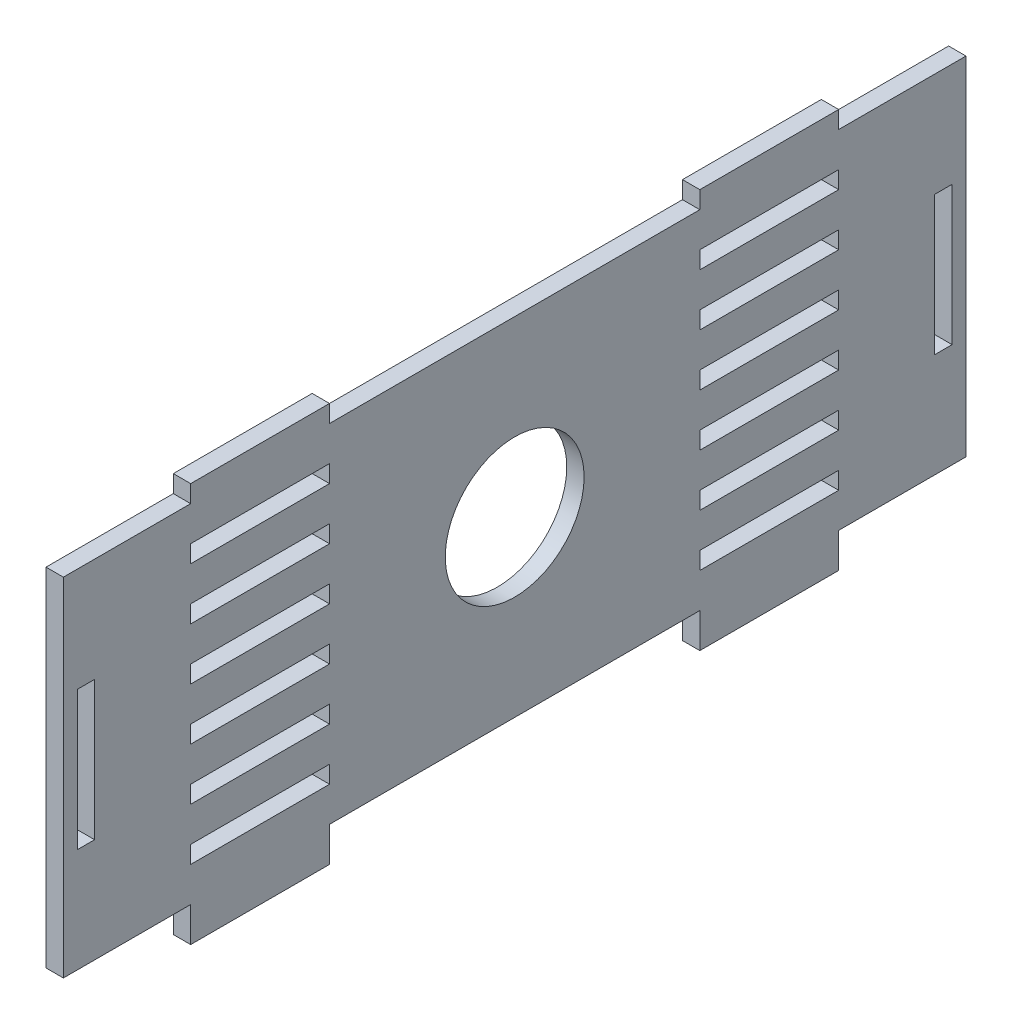
from build123d import *

# Parameters (mm, degrees)
SKETCH1_4_R         = 10
SKETCH1_4_W         = 2.5
SKETCH1_4_H         = 20
BOSS_EXTRUDE3_DEPTH = 1.25
SKETCH2_W           = 20
SKETCH2_H           = 2.5
CUT_EXTRUDE1_DEPTH  = 72.632743909


with BuildPart() as part:
    # Sketch1<4> → Boss-Extrude3 (new, symmetric)
    with BuildSketch(Plane(origin=(0, 0, 0), x_dir=(0, 0, -1), z_dir=(1, 0, 0))):
        Polygon((-26.666666667, -30), (-26.666666667, -25), (26.666666667, -25), (26.666666667, -30), (46.666666667, -30), (46.666666667, -25), (65, -25), (65, 25), (46.666666667, 25), (46.666666667, 27.5), (26.666666667, 27.5), (26.666666667, 25), (-26.666666667, 25), (-26.666666667, 27.5), (-46.666666667, 27.5), (-46.666666667, 25), (-65, 25), (-65, -25), (-46.666666667, -25), (-46.666666667, -30), align=None)
        Circle(SKETCH1_4_R, mode=Mode.SUBTRACT)
        with Locations((-61.75, 0)):
            Rectangle(SKETCH1_4_W, SKETCH1_4_H, mode=Mode.SUBTRACT)
        with Locations((61.75, 0)):
            Rectangle(SKETCH1_4_W, SKETCH1_4_H, mode=Mode.SUBTRACT)
    extrude(amount=BOSS_EXTRUDE3_DEPTH, both=True)

    # Sketch2 → Cut-Extrude1 (cut, through all)
    with BuildSketch(Plane(origin=(1.25, 0, 0), x_dir=(0, 0, -1), z_dir=(1, 0, 0))):
        with Locations((-36.666666667, 18.75)):
            Rectangle(SKETCH2_W, SKETCH2_H)
        with Locations((-36.666666667, 11.25)):
            Rectangle(SKETCH2_W, SKETCH2_H)
        with Locations((-36.666666667, 3.75)):
            Rectangle(SKETCH2_W, SKETCH2_H)
        with Locations((-36.666666667, -3.75)):
            Rectangle(SKETCH2_W, SKETCH2_H)
        with Locations((-36.666666667, -11.25)):
            Rectangle(SKETCH2_W, SKETCH2_H)
        with Locations((-36.666666667, -18.75)):
            Rectangle(SKETCH2_W, SKETCH2_H)
        with Locations((36.666666667, -18.75)):
            Rectangle(SKETCH2_W, SKETCH2_H)
        with Locations((36.666666667, -11.25)):
            Rectangle(SKETCH2_W, SKETCH2_H)
        with Locations((36.666666667, -3.75)):
            Rectangle(SKETCH2_W, SKETCH2_H)
        with Locations((36.666666667, 3.75)):
            Rectangle(SKETCH2_W, SKETCH2_H)
        with Locations((36.666666667, 11.25)):
            Rectangle(SKETCH2_W, SKETCH2_H)
        with Locations((36.666666667, 18.75)):
            Rectangle(SKETCH2_W, SKETCH2_H)
    extrude(amount=-CUT_EXTRUDE1_DEPTH, mode=Mode.SUBTRACT)


solid = part.part
